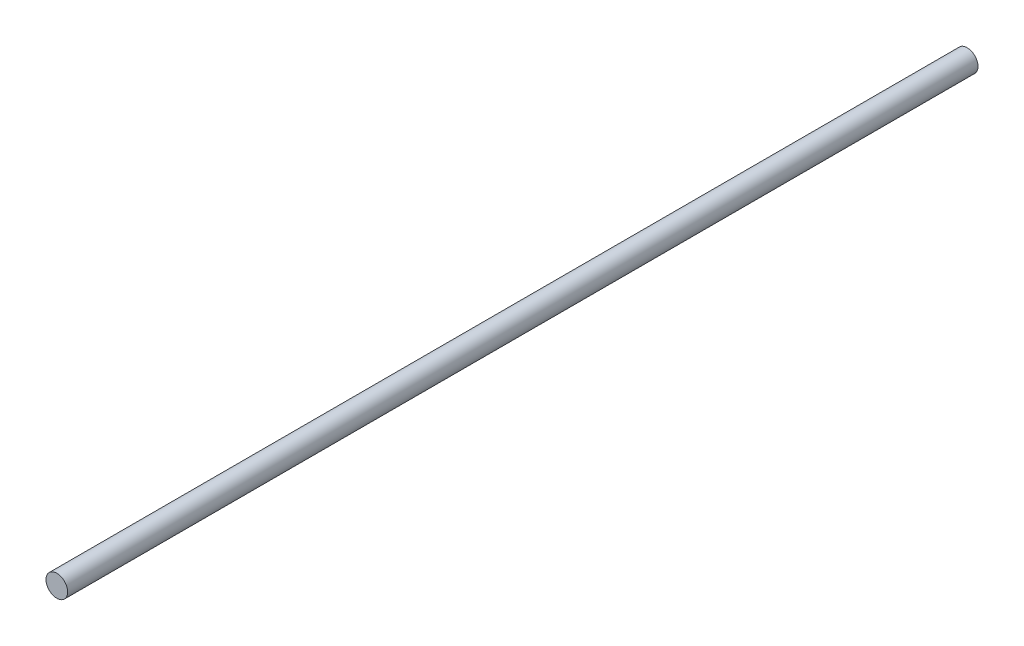
from build123d import *

# Parameters (mm, degrees)
SKETCH_1_R      = 4
EXTRUDE_1_DEPTH = 335.9


with BuildPart() as part:
    # 草图1 → 凸台-拉伸1 (new body)
    with BuildSketch(Plane.XY):
        Circle(SKETCH_1_R)
    extrude(amount=EXTRUDE_1_DEPTH)


solid = part.part
